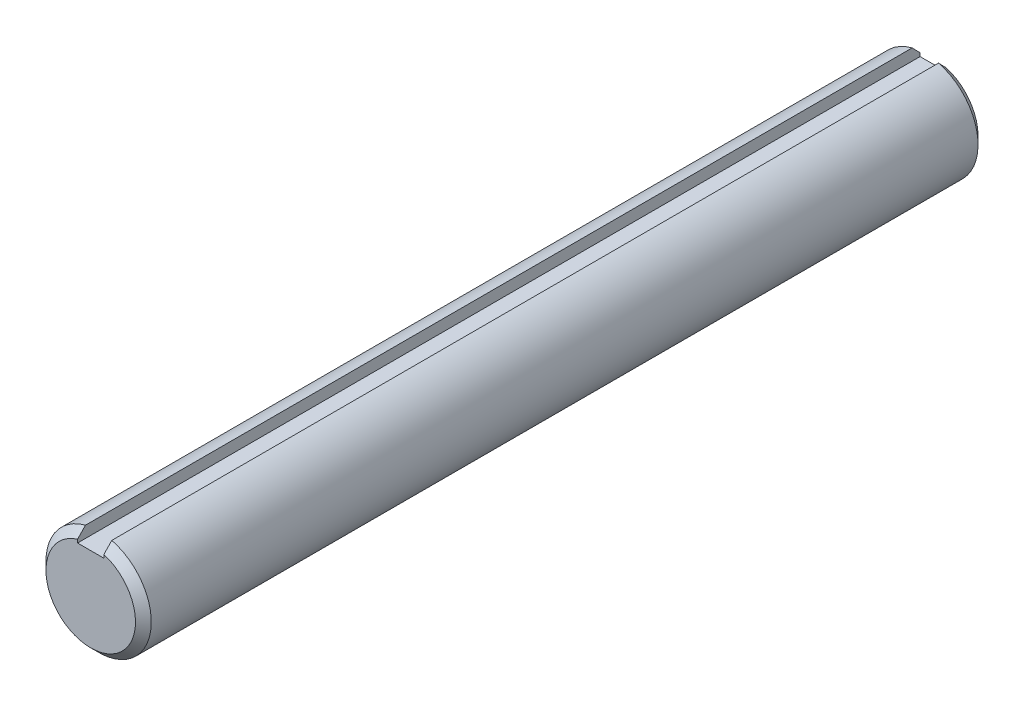
from build123d import *

# Parameters (mm, degrees)
SKETCH1_R           = 4.7625
EXTRUDE1_DEPTH      = 38.1
CHAMFER1_SIZE       = 0.714375
EXTRUDE2_DEPTH      = 39.690732902
EXTRUDE2_DEPTH_BACK = 39.690732902
SKETCH3_W           = 2.38125
SKETCH3_H           = 1.190625


with BuildPart() as part:
    # Sketch1 → Extrude1 (new, symmetric)
    with BuildSketch(Plane.XY):
        with Locations(Location((0, 0, 0), (0, 0, 180))):
            Circle(SKETCH1_R)
    extrude(amount=EXTRUDE1_DEPTH, both=True)

    # Chamfer1
    chamfer1_edges = [part.edges().sort_by_distance(p)[0] for p in [
        (4.7625, 0, -38.1),
        (4.7625, 0, 38.1),
    ]]
    chamfer(chamfer1_edges, length=CHAMFER1_SIZE)

    # Sketch3 → Extrude2 (cut, two sides: drawn at the far end of the back side and taken through both)
    with BuildSketch(Plane.XY.offset(-EXTRUDE2_DEPTH_BACK)):
        with Locations((0, 4.1671875)):
            Rectangle(SKETCH3_W, SKETCH3_H)
    extrude(amount=EXTRUDE2_DEPTH + EXTRUDE2_DEPTH_BACK, mode=Mode.SUBTRACT)


solid = part.part
